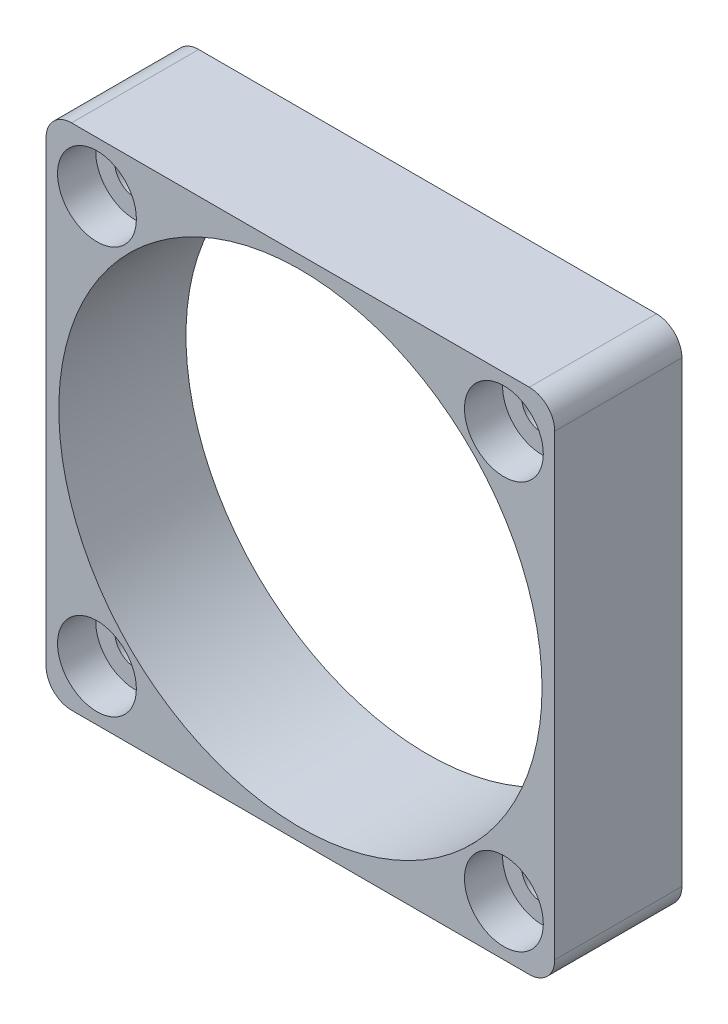
from build123d import *

# Parameters (mm, degrees)
SKETCH1_W           = 40
SKETCH1_H           = 40
BOSS_EXTRUDE1_DEPTH = 10
SKETCH2_R           = 19
SKETCH2_R_2         = 1.6
CUT_EXTRUDE1_DEPTH  = 31
FILLET1_R           = 2
SKETCH3_R           = 3.1
CUT_EXTRUDE2_DEPTH  = 3


with BuildPart() as part:
    # Sketch1 → Boss-Extrude1 (new body)
    with BuildSketch(Plane.XY):
        Rectangle(SKETCH1_W, SKETCH1_H)
    extrude(amount=BOSS_EXTRUDE1_DEPTH)

    # Sketch2 → Cut-Extrude1 (cut, through all)
    with BuildSketch(Plane.XY.offset(10)):
        Circle(SKETCH2_R)
        with Locations((-16, 16)):
            Circle(SKETCH2_R_2)
        with Locations((16, 16)):
            Circle(SKETCH2_R_2)
        with Locations((16, -16)):
            Circle(SKETCH2_R_2)
        with Locations((-16, -16)):
            Circle(SKETCH2_R_2)
    extrude(amount=-CUT_EXTRUDE1_DEPTH, mode=Mode.SUBTRACT)

    # Fillet1
    fillet1_edges = [part.edges().sort_by_distance(p)[0] for p in [
        (20, -20, 5),
        (-20, -20, 5),
        (-20, 20, 5),
        (20, 20, 5),
    ]]
    fillet(fillet1_edges, radius=FILLET1_R)

    # Sketch3 → Cut-Extrude2 (cut)
    with BuildSketch(Plane.XY.offset(10)):
        with Locations((-16, -16)):
            Circle(SKETCH3_R)
        with Locations((16, -16)):
            Circle(SKETCH3_R)
        with Locations((16, 16)):
            Circle(SKETCH3_R)
        with Locations((-16, 16)):
            Circle(SKETCH3_R)
    extrude(amount=-CUT_EXTRUDE2_DEPTH, mode=Mode.SUBTRACT)


solid = part.part
